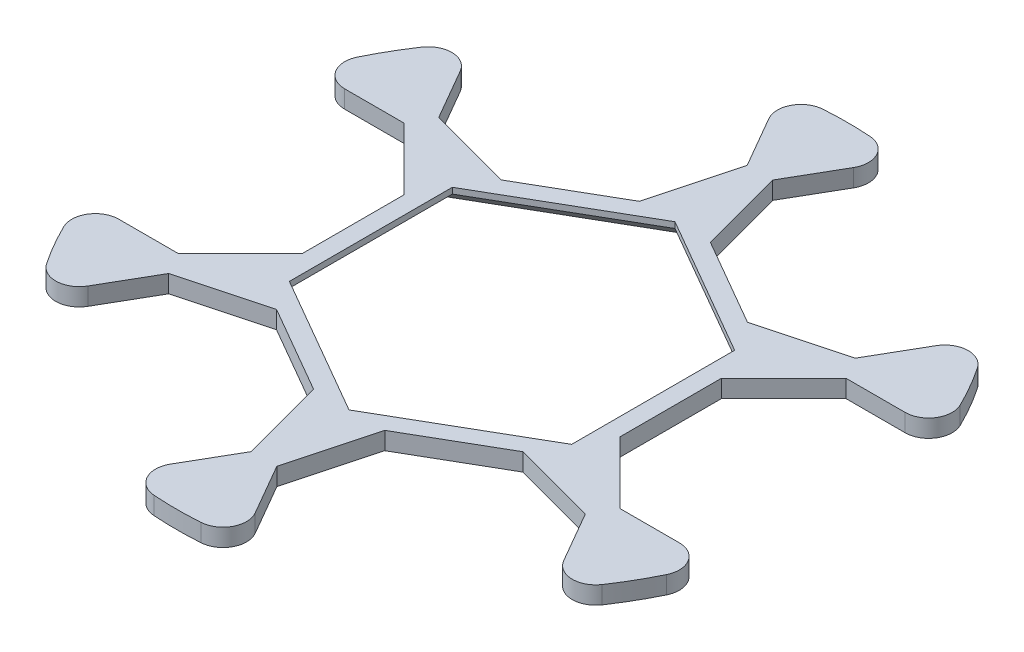
from build123d import *

# Parameters (mm, degrees)
SKETCH1_R               = 28.5
SKETCH1_R_2             = 12.7
BOSS_EXTRUDE1_DEPTH     = 2
SKETCH2_R               = 28.5
BOSS_EXTRUDE2_DEPTH     = 1
SKETCH3_R               = 11
BOSS_EXTRUDE3_DEPTH     = 7
CUT_EXTRUDE1_DEPTH      = 42.527099586
CUT_EXTRUDE1_DEPTH_BACK = 42.527099586
SKETCH4_R               = 9.65
SKETCH5_R               = 11
SKETCH5_R_2             = 8
BOSS_EXTRUDE4_DEPTH     = 5
SKETCH6_R               = 12.7
SKETCH6_R_2             = 9.65
BOSS_EXTRUDE5_DEPTH     = 2
SKETCH13_R              = 28.5
CUT_EXTRUDE2_DEPTH      = 1
SKETCH12_W              = 2
SKETCH12_H              = 4
BOSS_EXTRUDE7_DEPTH     = 2
FILLET1_R               = 0.5
SKETCH14_R              = 28.5
SKETCH14_R_2            = 11
BOSS_EXTRUDE8_DEPTH     = 0.35
BOSS_EXTRUDE9_START     = 11.65
SKETCH15_R              = 9.65
BOSS_EXTRUDE9_DEPTH     = 11.65
CUT_EXTRUDE3_DEPTH      = 1.5
CHAMFER1_SIZE           = 1
FILLET2_R               = 2
SKETCH17_R              = 9.67
CUT_EXTRUDE4_DEPTH      = 9
CIRPATTERN1_COUNT       = 2
CIRPATTERN1_ANGLE       = 30
SKETCH18_W              = 2.800280384
SKETCH18_H              = 4.910480866
SKETCH18_W_2            = 2.857294562
SKETCH18_H_2            = 5.674760566
CUT_EXTRUDE5_DEPTH      = 10
SKETCH19_R              = 28.5
CUT_EXTRUDE6_DEPTH      = 0.85
FILLET3_R               = 0.5
SKETCH20_R              = 68.647150441
CUT_EXTRUDE7_DEPTH      = 0.7
CUT_EXTRUDE8_DEPTH      = 41.186658172
CUT_EXTRUDE8_DEPTH_BACK = 41.186658172
CUT_EXTRUDE9_START      = 10
CUT_EXTRUDE9_DEPTH      = 10
CHAMFER2_SIZE           = 1


with BuildPart() as part:
    # Sketch1 → Boss-Extrude1 (new body)
    with BuildSketch(Plane(origin=(0, 0, 0), x_dir=(1, 0, 0), z_dir=(0, 1, 0))):
        with Locations(Location((0, 0, 0), (0, 0, 270))):
            Circle(SKETCH1_R)
        with Locations(Location((0, 0, 0), (0, 0, 270))):
            Circle(SKETCH1_R_2, mode=Mode.SUBTRACT)
    extrude(amount=BOSS_EXTRUDE1_DEPTH)

    # Sketch2 → Boss-Extrude2 (add)
    with BuildSketch(Plane(origin=(0, 2, 0), x_dir=(1, 0, 0), z_dir=(0, 1, 0))):
        with Locations(Location((0, 0, 0), (0, 0, 270))):
            Circle(SKETCH2_R)
    extrude(amount=BOSS_EXTRUDE2_DEPTH)

    # Sketch3 → Boss-Extrude3 (add)
    with BuildSketch(Plane(origin=(0, 3, 0), x_dir=(1, 0, 0), z_dir=(0, 1, 0))):
        with Locations(Location((0, 0, 0), (0, 0, 270))):
            Circle(SKETCH3_R)
    extrude(amount=BOSS_EXTRUDE3_DEPTH)

    # Sketch4 → Cut-Extrude1 (cut, two sides: drawn at the far end of the back side and taken through both)
    with BuildSketch(Plane(origin=(0, 10, 0), x_dir=(1, 0, 0), z_dir=(0, 1, 0)).offset(-CUT_EXTRUDE1_DEPTH_BACK)):
        with Locations(Location((0, 0, 0), (0, 0, 270))):
            Circle(SKETCH4_R)
    extrude(amount=CUT_EXTRUDE1_DEPTH + CUT_EXTRUDE1_DEPTH_BACK, mode=Mode.SUBTRACT)

    # Sketch5 → Boss-Extrude4 (add)
    with BuildSketch(Plane(origin=(0, 10, 0), x_dir=(1, 0, 0), z_dir=(0, 1, 0))):
        with Locations(Location((0, 0, 0), (0, 0, 270))):
            Circle(SKETCH5_R)
        with Locations(Location((0, 0, 0), (0, 0, 270))):
            Circle(SKETCH5_R_2, mode=Mode.SUBTRACT)
    extrude(amount=BOSS_EXTRUDE4_DEPTH)

    # Sketch6 → Boss-Extrude5 (add)
    with BuildSketch(Plane.XZ.offset(-2)):
        Circle(SKETCH6_R)
        with Locations(Location((0, 0, 0), (0, 0, 90))):
            Circle(SKETCH6_R_2, mode=Mode.SUBTRACT)
    extrude(amount=BOSS_EXTRUDE5_DEPTH)

    # Sketch13 → Cut-Extrude2 (cut)
    with BuildSketch(Plane.XZ):
        with Locations(Location((0, 0, 0), (0, 0, 270))):
            Circle(SKETCH13_R)
    extrude(amount=-CUT_EXTRUDE2_DEPTH, mode=Mode.SUBTRACT)

    # Sketch12 → Boss-Extrude7 (add)
    with BuildSketch(Plane.XZ.offset(-1)):
        with Locations((25.5, 0)):
            Rectangle(SKETCH12_W, SKETCH12_H)
        with Locations((-25.5, 0)):
            Rectangle(SKETCH12_W, SKETCH12_H)
    boss_extrude7 = extrude(amount=BOSS_EXTRUDE7_DEPTH)

    # Fillet1
    fillet1_edges = [part.edges().sort_by_distance(p)[0] for p in [
        (24.5, 0, 2),
        (24.5, 0, -2),
        (26.5, 0, -2),
        (26.5, 0, 2),
        (-24.5, 0, -2),
        (-24.5, 0, 2),
        (-26.5, 0, 2),
        (-26.5, 0, -2),
    ]]
    fillet(fillet1_edges, radius=FILLET1_R)

    # Sketch14 → Boss-Extrude8 (add)
    with BuildSketch(Plane(origin=(0, 3, 0), x_dir=(1, 0, 0), z_dir=(0, 1, 0))):
        with Locations(Location((0, 0, 0), (0, 0, 90))):
            Circle(SKETCH14_R)
        with Locations(Location((0, 0, 0), (0, 0, 270))):
            Circle(SKETCH14_R_2, mode=Mode.SUBTRACT)
    extrude(amount=BOSS_EXTRUDE8_DEPTH)

    # Sketch15 → Boss-Extrude9 (add)
    with BuildSketch(Plane(origin=(0, 3.35, 0), x_dir=(1, 0, 0), z_dir=(0, 1, 0)).offset(BOSS_EXTRUDE9_START)):
        Polygon((0, -12.990381057), (11.25, -6.495190528), (11.25, 6.495190528), (0, 12.990381057), (-11.25, 6.495190528), (-11.25, -6.495190528), align=None)
        with Locations(Location((0, 0, 0), (0, 0, 270))):
            Circle(SKETCH15_R, mode=Mode.SUBTRACT)
    extrude(amount=-BOSS_EXTRUDE9_DEPTH)

    # Sketch16 → Cut-Extrude3 (cut)
    with BuildSketch(Plane(origin=(0, 3.35, 0), x_dir=(1, 0, 0), z_dir=(0, 1, 0))):
        Polygon((-6.186156124, -29.91473671), (-22.813843876, -20.31473671), (-17.713843876, -11.481277591), (-10.473909236, -9.541342951), (-3.026090764, -13.841342951), (-1.086156124, -21.081277591), align=None)
        Polygon((-13.5, -4.3), (-18.8, -9.6), (-29, -9.6), (-29, 9.6), (-18.8, 9.6), (-13.5, 4.3), align=None)
        Polygon((-10.473909236, 9.541342951), (-17.713843876, 11.481277591), (-22.813843876, 20.31473671), (-6.186156124, 29.91473671), (-1.086156124, 21.081277591), (-3.026090764, 13.841342951), align=None)
        Polygon((3.026090764, 13.841342951), (1.086156124, 21.081277591), (6.186156124, 29.91473671), (22.813843876, 20.31473671), (17.713843876, 11.481277591), (10.473909236, 9.541342951), align=None)
        Polygon((13.5, 4.3), (18.8, 9.6), (29, 9.6), (29, -9.6), (18.8, -9.6), (13.5, -4.3), align=None)
        Polygon((10.473909236, -9.541342951), (17.713843876, -11.481277591), (22.813843876, -20.31473671), (6.186156124, -29.91473671), (1.086156124, -21.081277591), (3.026090764, -13.841342951), align=None)
    extrude(amount=-CUT_EXTRUDE3_DEPTH, mode=Mode.SUBTRACT)

    # Chamfer1
    chamfer1_edges = [part.edges().sort_by_distance(p)[0] for p in [
        (0, 10, -8),
    ]]
    chamfer(chamfer1_edges, length=CHAMFER1_SIZE)

    # Fillet2
    fillet2_edges = [part.edges().sort_by_distance(p)[0] for p in [
        (-21.731090241, 2.425, 18.439352401),
        (-5.103402488, 2.425, 28.039352401),
        (21.731090241, 2.6, 18.439352401),
        (5.103402488, 2.6, 28.039352401),
        (5.103402488, 2.6, -28.039352401),
        (21.731090241, 2.6, -18.439352401),
        (26.834492729, 2.6, -9.6),
        (26.834492729, 2.6, 9.6),
        (-26.834492729, 2.425, 9.6),
        (-26.834492729, 2.425, -9.6),
        (-21.731090241, 2.425, -18.439352401),
        (-5.103402488, 2.425, -28.039352401),
    ]]
    fillet(fillet2_edges, radius=FILLET2_R)

    # Sketch17 → Cut-Extrude4 (cut)
    with BuildSketch(Plane.XZ.offset(-1)):
        with Locations(Location((0, 0, 0), (0, 0, 270))):
            Circle(SKETCH17_R)
    extrude(amount=-CUT_EXTRUDE4_DEPTH, mode=Mode.SUBTRACT)

    # CirPattern1: Boss-Extrude7 ×2 about axis
    cirpattern1_axis = Axis((0, 0, 0), (0, -1, 0))
    for i in range(1, CIRPATTERN1_COUNT):
        add(boss_extrude7.rotate(cirpattern1_axis, i * CIRPATTERN1_ANGLE / (CIRPATTERN1_COUNT - 1)))

    # Sketch18 → Cut-Extrude5 (cut)
    with BuildSketch(Plane.XZ.offset(-1)):
        with Locations((-25.5, 0)):
            Rectangle(SKETCH18_W, SKETCH18_H)
        with Locations((25.5, 0)):
            Rectangle(SKETCH18_W_2, SKETCH18_H_2)
    extrude(amount=CUT_EXTRUDE5_DEPTH, mode=Mode.SUBTRACT)

    # Sketch19 → Cut-Extrude6 (cut)
    with BuildSketch(Plane.XZ.offset(-1)):
        Circle(SKETCH19_R)
        Polygon((21.9496732, 14.982050808), (20.217622393, 13.982050808), (22.217622393, 10.517949192), (23.9496732, 11.517949192), align=None, mode=Mode.SUBTRACT)
        Polygon((-23.9496732, -11.517949192), (-21.9496732, -14.982050808), (-20.217622393, -13.982050808), (-22.217622393, -10.517949192), align=None, mode=Mode.SUBTRACT)
    extrude(amount=-CUT_EXTRUDE6_DEPTH, mode=Mode.SUBTRACT)

    # Fillet3
    fillet3_edges = [part.edges().sort_by_distance(p)[0] for p in [
        (20.217622393, 0.425, 13.982050808),
        (22.217622393, 0.425, 10.517949192),
        (23.9496732, 0.425, 11.517949192),
        (21.9496732, 0.425, 14.982050808),
        (-20.217622393, 0.425, -13.982050808),
        (-22.217622393, 0.425, -10.517949192),
        (-23.9496732, 0.425, -11.517949192),
        (-21.9496732, 0.425, -14.982050808),
    ]]
    fillet(fillet3_edges, radius=FILLET3_R)

    # Sketch20 → Cut-Extrude7 (cut)
    with BuildSketch(Plane.XZ.offset(1)):
        Circle(SKETCH20_R)
    extrude(amount=-CUT_EXTRUDE7_DEPTH, mode=Mode.SUBTRACT)

    # Sketch21 → Cut-Extrude8 (cut, two sides: drawn at the far end of the back side and taken through both)
    with BuildSketch(Plane(origin=(0, 3.35, 0), x_dir=(1, 0, 0), z_dir=(0, 1, 0)).offset(-CUT_EXTRUDE8_DEPTH_BACK)):
        Polygon((0, 13.856406461), (-12, 6.92820323), (-12, -6.92820323), (0, -13.856406461), (12, -6.92820323), (12, 6.92820323), align=None)
    extrude(amount=CUT_EXTRUDE8_DEPTH + CUT_EXTRUDE8_DEPTH_BACK, mode=Mode.SUBTRACT)

    # Sketch22 → Cut-Extrude9 (cut)
    with BuildSketch(Plane.XZ.offset(-1.85).offset(CUT_EXTRUDE9_START)):
        with BuildLine():
            Line((3.59927914, -25.434134341), (1.086156124, -21.081277591))
            Line((1.086156124, -21.081277591), (3.026090764, -13.841342951))
            Line((3.026090764, -13.841342951), (10.473909236, -9.541342951))
            Line((10.473909236, -9.541342951), (17.713843876, -11.481277591))
            Line((17.713843876, -11.481277591), (20.226966893, -15.834134341))
            ThreePointArc((20.226966893, -15.834134341), (21.88851243, -16.832891206), (23.616302055, -15.95369165))
            ThreePointArc((23.616302055, -15.95369165), (24.681724008, -14.25), (25.62445328, -12.475471698))
            ThreePointArc((25.62445328, -12.475471698), (25.521967619, -10.539562212), (23.826246032, -9.6))
            Line((23.826246032, -9.6), (18.8, -9.6))
            Line((18.8, -9.6), (13.5, -4.3))
            Line((13.5, -4.3), (13.5, 4.3))
            Line((13.5, 4.3), (18.8, 9.6))
            Line((18.8, 9.6), (23.826246032, 9.6))
            ThreePointArc((23.826246032, 9.6), (25.521967619, 10.539562212), (25.62445328, 12.475471698))
            ThreePointArc((25.62445328, 12.475471698), (24.681724008, 14.25), (23.616302055, 15.95369165))
            ThreePointArc((23.616302055, 15.95369165), (21.88851243, 16.832891206), (20.226966893, 15.834134341))
            Line((20.226966893, 15.834134341), (17.713843876, 11.481277591))
            Line((17.713843876, 11.481277591), (10.473909236, 9.541342951))
            Line((10.473909236, 9.541342951), (3.026090764, 13.841342951))
            Line((3.026090764, 13.841342951), (1.086156124, 21.081277591))
            Line((1.086156124, 21.081277591), (3.59927914, 25.434134341))
            ThreePointArc((3.59927914, 25.434134341), (3.633455189, 27.372453418), (2.008151225, 28.429163348))
            ThreePointArc((2.008151225, 28.429163348), (0, 28.5), (-2.008151225, 28.429163348))
            ThreePointArc((-2.008151225, 28.429163348), (-3.633455189, 27.372453418), (-3.59927914, 25.434134341))
            Line((-3.59927914, 25.434134341), (-1.086156124, 21.081277591))
            Line((-1.086156124, 21.081277591), (-3.026090764, 13.841342951))
            Line((-3.026090764, 13.841342951), (-10.473909236, 9.541342951))
            Line((-10.473909236, 9.541342951), (-17.713843876, 11.481277591))
            Line((-17.713843876, 11.481277591), (-20.226966893, 15.834134341))
            ThreePointArc((-20.226966893, 15.834134341), (-21.88851243, 16.832891206), (-23.616302055, 15.95369165))
            ThreePointArc((-23.616302055, 15.95369165), (-24.681724008, 14.25), (-25.62445328, 12.475471698))
            ThreePointArc((-25.62445328, 12.475471698), (-25.521967619, 10.539562212), (-23.826246032, 9.6))
            Line((-23.826246032, 9.6), (-18.8, 9.6))
            Line((-18.8, 9.6), (-13.5, 4.3))
            Line((-13.5, 4.3), (-13.5, -4.3))
            Line((-13.5, -4.3), (-18.8, -9.6))
            Line((-18.8, -9.6), (-23.826246032, -9.6))
            ThreePointArc((-23.826246032, -9.6), (-25.521967619, -10.539562212), (-25.62445328, -12.475471698))
            ThreePointArc((-25.62445328, -12.475471698), (-24.681724008, -14.25), (-23.616302055, -15.95369165))
            ThreePointArc((-23.616302055, -15.95369165), (-21.88851243, -16.832891206), (-20.226966893, -15.834134341))
            Line((-20.226966893, -15.834134341), (-17.713843876, -11.481277591))
            Line((-17.713843876, -11.481277591), (-10.473909236, -9.541342951))
            Line((-10.473909236, -9.541342951), (-3.026090764, -13.841342951))
            Line((-3.026090764, -13.841342951), (-1.086156124, -21.081277591))
            Line((-1.086156124, -21.081277591), (-3.59927914, -25.434134341))
            ThreePointArc((-3.59927914, -25.434134341), (-3.633455189, -27.372453418), (-2.008151225, -28.429163348))
            ThreePointArc((-2.008151225, -28.429163348), (0, -28.5), (2.008151225, -28.429163348))
            ThreePointArc((2.008151225, -28.429163348), (3.633455189, -27.372453418), (3.59927914, -25.434134341))
        make_face()
    extrude(amount=-CUT_EXTRUDE9_DEPTH, mode=Mode.SUBTRACT)

    # Chamfer2
    chamfer2_edges = [part.edges().sort_by_distance(p)[0] for p in [
        (-6, 1.85, -10.392304845),
        (-12, 1.85, 0),
        (-6, 1.85, 10.392304845),
        (6, 1.85, 10.392304845),
        (12, 1.85, 0),
        (6, 1.85, -10.392304845),
    ]]
    chamfer(chamfer2_edges, length=CHAMFER2_SIZE)


solid = part.part
